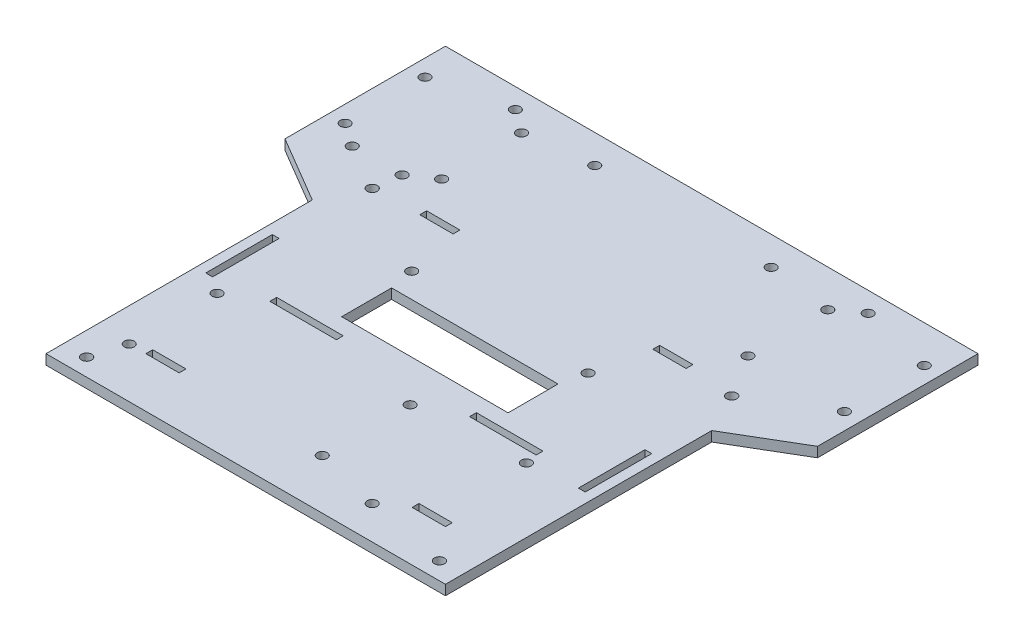
from build123d import *

# Parameters (mm, degrees)
SKETCH1_W           = 120
SKETCH1_H           = 140
BOSS_EXTRUDE1_DEPTH = 3
SKETCH2_R           = 1.5
CUT_EXTRUDE1_DEPTH  = 107.343782141
SKETCH3_R           = 1.5
CUT_EXTRUDE3_DEPTH  = 107.343782141
SKETCH4_R           = 1.5
CUT_EXTRUDE4_DEPTH  = 107.343782141
SKETCH5_R           = 1.5
CUT_EXTRUDE5_DEPTH  = 3
SKETCH6_R           = 1.525
SKETCH6_W           = 10
SKETCH6_H           = 2.05
SKETCH6_W_2         = 20
CUT_EXTRUDE7_DEPTH  = 107.343782141
SKETCH9_R           = 1.525
CUT_EXTRUDE8_DEPTH  = 3
SKETCH10_W          = 50
SKETCH10_H          = 15
CUT_EXTRUDE9_DEPTH  = 5
SKETCH11_R          = 1.5
CUT_EXTRUDE10_DEPTH = 5
SKETCH12_W          = 2.05
SKETCH12_H          = 20
CUT_EXTRUDE11_DEPTH = 10


with BuildPart() as part:
    # Sketch1 → Boss-Extrude1 (new body)
    with BuildSketch(Plane(origin=(0, 0, 0), x_dir=(1, 0, 0), z_dir=(0, 1, 0))):
        Rectangle(SKETCH1_W, SKETCH1_H)
        Polygon((-80, 21.791828604), (-60, 10), (-60, 70), (-80, 70), align=None)
        Polygon((80, 70), (60, 70), (60, 10), (80, 21.791828604), align=None)
    extrude(amount=BOSS_EXTRUDE1_DEPTH)

    # Sketch2 → Cut-Extrude1 (cut, through all)
    with BuildSketch(Plane(origin=(0, 3, 0), x_dir=(1, 0, 0), z_dir=(0, 1, 0))):
        with Locations(Location((28, -60, 0), (0, 0, 270))):
            Circle(SKETCH2_R)
        with Locations(Location((40.6, -26.277010809, 0), (0, 0, 270))):
            Circle(SKETCH2_R)
        with Locations(Location((-50, -55, 0), (0, 0, 270))):
            Circle(SKETCH2_R)
        with Locations(Location((8, -55, 0), (0, 0, 270))):
            Circle(SKETCH2_R)
        with Locations(Location((-50, -28.6, 0), (0, 0, 270))):
            Circle(SKETCH2_R)
        with Locations(Location((8, -28.6, 0), (0, 0, 270))):
            Circle(SKETCH2_R)
    extrude(amount=-CUT_EXTRUDE1_DEPTH, mode=Mode.SUBTRACT)

    # Sketch3 → Cut-Extrude3 (cut, through all)
    with BuildSketch(Plane(origin=(0, 3, 0), x_dir=(1, 0, 0), z_dir=(0, 1, 0))):
        with Locations(Location((-26.529579069, 61.385555627, 0), (0, 0, 270))):
            Circle(SKETCH3_R)
        with Locations(Location((-26.529579069, 6.385555627, 0), (0, 0, 90))):
            Circle(SKETCH3_R)
        with Locations(Location((26.470420931, 6.385555627, 0), (0, 0, 270))):
            Circle(SKETCH3_R)
        with Locations(Location((26.470420931, 61.385555627, 0), (0, 0, 90))):
            Circle(SKETCH3_R)
    extrude(amount=-CUT_EXTRUDE3_DEPTH, mode=Mode.SUBTRACT)

    # Sketch4 → Cut-Extrude4 (cut, through all)
    with BuildSketch(Plane(origin=(0, 3, 0), x_dir=(1, 0, 0), z_dir=(0, 1, 0))):
        with Locations(Location((-75, 34.863883517, 0), (0, 0, 270))):
            Circle(SKETCH4_R)
        with Locations(Location((-75, 58.863883517, 0), (0, 0, 270))):
            Circle(SKETCH4_R)
        with Locations(Location((-46, 34.863883517, 0), (0, 0, 90))):
            Circle(SKETCH4_R)
        with Locations(Location((-46, 58.863883517, 0), (0, 0, 90))):
            Circle(SKETCH4_R)
        with Locations(Location((46, 58.863883517, 0), (0, 0, 270))):
            Circle(SKETCH4_R)
        with Locations(Location((46, 34.863883517, 0), (0, 0, 270))):
            Circle(SKETCH4_R)
        with Locations(Location((75, 34.863883517, 0), (0, 0, 90))):
            Circle(SKETCH4_R)
        with Locations(Location((75, 58.863883517, 0), (0, 0, 90))):
            Circle(SKETCH4_R)
    extrude(amount=-CUT_EXTRUDE4_DEPTH, mode=Mode.SUBTRACT)

    # Sketch5 → Cut-Extrude5 (cut)
    with BuildSketch(Plane(origin=(0, 3, 0), x_dir=(1, 0, 0), z_dir=(0, 1, 0))):
        with Locations(Location((-68, 30, 0), (0, 0, 270))):
            Circle(SKETCH5_R)
        with Locations(Location((-53, 30, 0), (0, 0, 270))):
            Circle(SKETCH5_R)
    extrude(amount=-CUT_EXTRUDE5_DEPTH, mode=Mode.SUBTRACT)

    # Sketch6 → Cut-Extrude7 (cut, through all)
    with BuildSketch(Plane(origin=(0, 3, 0), x_dir=(1, 0, 0), z_dir=(0, 1, 0))):
        with Locations(Location((-53, -64.8, 0), (0, 0, 270))):
            Circle(SKETCH6_R)
        with Locations(Location((53, -64.8, 0), (0, 0, 90))):
            Circle(SKETCH6_R)
        with Locations((-40, -53.975)):
            Rectangle(SKETCH6_W, SKETCH6_H)
        with Locations((40, -53.975)):
            Rectangle(SKETCH6_W, SKETCH6_H)
        with Locations((30, -21.725)):
            Rectangle(SKETCH6_W_2, SKETCH6_H)
        with Locations((-30, -21.725)):
            Rectangle(SKETCH6_W_2, SKETCH6_H)
        with Locations((35, 23.325)):
            Rectangle(SKETCH6_W, SKETCH6_H)
        with Locations((-35, 23.325)):
            Rectangle(SKETCH6_W, SKETCH6_H)
    extrude(amount=-CUT_EXTRUDE7_DEPTH, mode=Mode.SUBTRACT)

    # Sketch9 → Cut-Extrude8 (cut)
    with BuildSketch(Plane(origin=(0, 3, 0), x_dir=(1, 0, 0), z_dir=(0, 1, 0))):
        with Locations(Location((-54, 22, 0), (0, 0, 270))):
            Circle(SKETCH9_R)
        with Locations(Location((54, 22, 0), (0, 0, 90))):
            Circle(SKETCH9_R)
    extrude(amount=-CUT_EXTRUDE8_DEPTH, mode=Mode.SUBTRACT)

    # Sketch10 → Cut-Extrude9 (cut)
    with BuildSketch(Plane(origin=(0, 3, 0), x_dir=(1, 0, 0), z_dir=(0, 1, 0))):
        with Locations((-0.2, -8.475074484)):
            Rectangle(SKETCH10_W, SKETCH10_H)
    extrude(amount=-CUT_EXTRUDE9_DEPTH, mode=Mode.SUBTRACT)

    # Sketch11 → Cut-Extrude10 (cut)
    with BuildSketch(Plane(origin=(0, 3, 0), x_dir=(1, 0, 0), z_dir=(0, 1, 0))):
        with Locations(Location((-53, 64, 0), (0, 0, 270))):
            Circle(SKETCH11_R)
        with Locations(Location((53, 64, 0), (0, 0, 270))):
            Circle(SKETCH11_R)
    extrude(amount=-CUT_EXTRUDE10_DEPTH, mode=Mode.SUBTRACT)

    # Sketch12 → Cut-Extrude11 (cut)
    with BuildSketch(Plane(origin=(0, 3, 0), x_dir=(1, 0, 0), z_dir=(0, 1, 0))):
        with Locations((-55.975, -15)):
            Rectangle(SKETCH12_W, SKETCH12_H)
        with Locations((55.975, -15)):
            Rectangle(SKETCH12_W, SKETCH12_H)
    extrude(amount=-CUT_EXTRUDE11_DEPTH, mode=Mode.SUBTRACT)


solid = part.part
